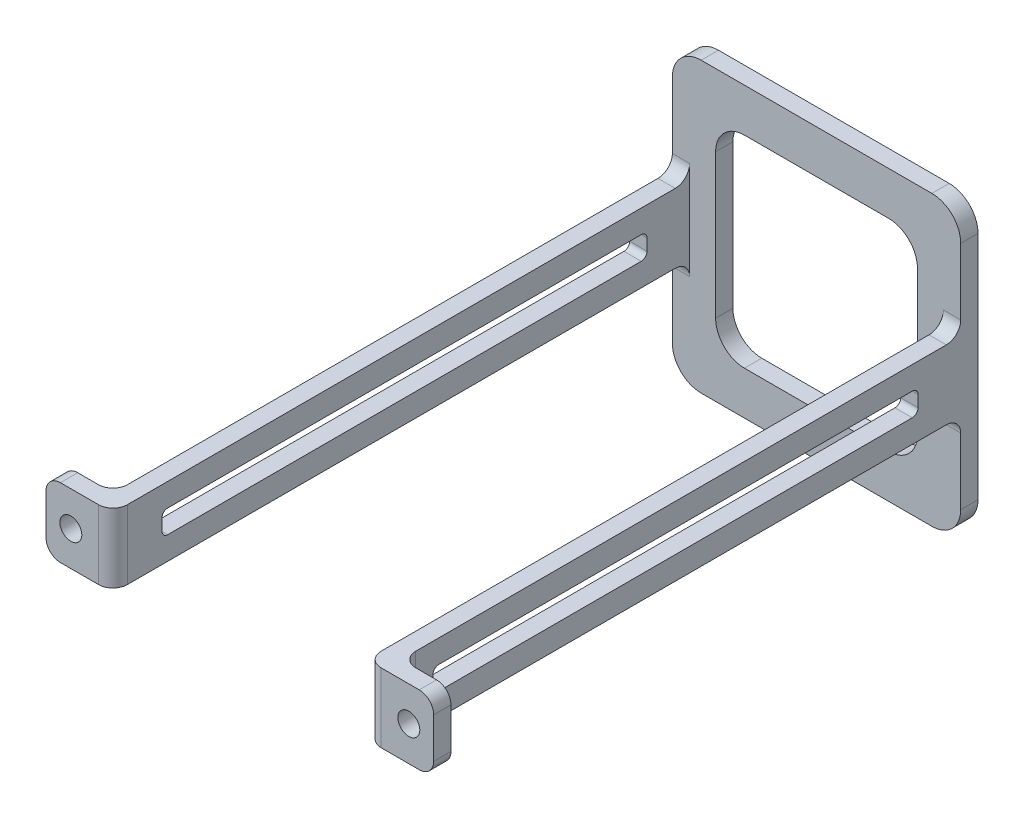
from build123d import *

# Parameters (mm, degrees)
BOSS_EXTRUDE1_DEPTH = 6
SKETCH2_W           = 50
SKETCH2_H           = 3
BOSS_EXTRUDE2_DEPTH = 25
CUT_EXTRUDE1_DEPTH  = 50
CUT_EXTRUDE2_DEPTH  = 25
FILLET1_R           = 5
FILLET2_R           = 2.5
CUT_EXTRUDE3_DEPTH  = 88


with BuildPart() as part:
    # Sketch1 → Boss-Extrude1 (new, symmetric)
    with BuildSketch(Plane(origin=(0, 0, 0), x_dir=(1, 0, 0), z_dir=(0, 1, 0))):
        Polygon((0, 0), (11.610474965, 0), (11.610474965, 3), (3, 3), (3, 100), (3, 103), (-47, 103), (-47, 100), (-47, 3), (-55.610474965, 3), (-55.610474965, 0), (-44, 0), (-44, 100), (0, 100), align=None)
    extrude(amount=BOSS_EXTRUDE1_DEPTH, both=True)

    # Sketch2 → Boss-Extrude2 (add, symmetric)
    with BuildSketch(Plane(origin=(0, 0, 0), x_dir=(1, 0, 0), z_dir=(0, 1, 0))):
        with Locations((-22, 101.5)):
            Rectangle(SKETCH2_W, SKETCH2_H)
    extrude(amount=BOSS_EXTRUDE2_DEPTH, both=True)

    # Sketch4 → Cut-Extrude1 (cut)
    with BuildSketch(Plane(origin=(0, 0, -3), x_dir=(-1, 0, 0), z_dir=(0, 0, -1))):
        with BuildLine():
            ThreePointArc((53.205237482, 0), (52.172824783, 1.690352707), (50.197561403, 1.543714256))
            Line((50.197561403, 1.543714256), (52.412913562, -1.543714256))
            ThreePointArc((52.412913562, -1.543714256), (52.99559019, -0.867587301), (53.205237482, 0))
        make_face()
        with BuildLine():
            Line((52.412913562, -1.543714256), (50.197561403, 1.543714256))
            ThreePointArc((50.197561403, 1.543714256), (49.761523227, -1.107676079), (52.412913562, -1.543714256))
        make_face()
    cut_extrude1 = extrude(amount=-CUT_EXTRUDE1_DEPTH, mode=Mode.SUBTRACT)

    # Mirror1: Cut-Extrude1 across plane
    add(cut_extrude1.mirror(Plane(origin=(-22, 0, 0), x_dir=(0, 0, 1), z_dir=(1, 0, 0))), mode=Mode.SUBTRACT)

    # Sketch6 → Cut-Extrude2 (cut, symmetric)
    with BuildSketch(Plane(origin=(0, 0, -103), x_dir=(-1, 0, 0), z_dir=(0, 0, -1))):
        with BuildLine():
            Line((9.5, -17.5), (34.5, -17.5))
            ThreePointArc((34.5, -17.5), (38.035533906, -16.035533906), (39.5, -12.5))
            Line((39.5, -12.5), (39.5, 12.5))
            ThreePointArc((39.5, 12.5), (38.035533906, 16.035533906), (34.5, 17.5))
            Line((34.5, 17.5), (9.5, 17.5))
            ThreePointArc((9.5, 17.5), (5.964466094, 16.035533906), (4.5, 12.5))
            Line((4.5, 12.5), (4.5, -12.5))
            ThreePointArc((4.5, -12.5), (5.964466094, -16.035533906), (9.5, -17.5))
        make_face()
    extrude(amount=CUT_EXTRUDE2_DEPTH, both=True, mode=Mode.SUBTRACT)

    # Fillet1
    fillet1_edges = [part.edges().sort_by_distance(p)[0] for p in [
        (3, 25, -101.5),
        (-47, -25, -101.5),
        (-47, 25, -101.5),
        (3, -25, -101.5),
    ]]
    fillet(fillet1_edges, radius=FILLET1_R)

    # Fillet2
    fillet2_edges = [part.edges().sort_by_distance(p)[0] for p in [
        (11.610474965, 6, -1.5),
        (-55.610474965, -6, -1.5),
        (11.610474965, -6, -1.5),
        (-44, 0, 0),
        (-47, 0, -3),
        (3, 0, -3),
        (0, 0, 0),
        (1.5, -6, -100),
        (-45.5, -6, -100),
        (-55.610474965, 6, -1.5),
        (-45.5, 6, -100),
        (1.5, 6, -100),
    ]]
    fillet(fillet2_edges, radius=FILLET2_R)

    # Sketch7 → Cut-Extrude3 (cut)
    with BuildSketch(Plane.ZY.offset(47)):
        with BuildLine():
            Line((-91.604504773, 2), (-9.5, 2))
            ThreePointArc((-9.5, 2), (-8.792893219, 1.707106781), (-8.5, 1))
            Line((-8.5, 1), (-8.5, -1))
            ThreePointArc((-8.5, -1), (-8.792893219, -1.707106781), (-9.5, -2))
            Line((-9.5, -2), (-91.604504773, -2))
            ThreePointArc((-91.604504773, -2), (-92.311611555, -1.707106781), (-92.604504773, -1))
            Line((-92.604504773, -1), (-92.604504773, 1))
            ThreePointArc((-92.604504773, 1), (-92.311611555, 1.707106781), (-91.604504773, 2))
        make_face()
    extrude(amount=-CUT_EXTRUDE3_DEPTH, mode=Mode.SUBTRACT)


solid = part.part
